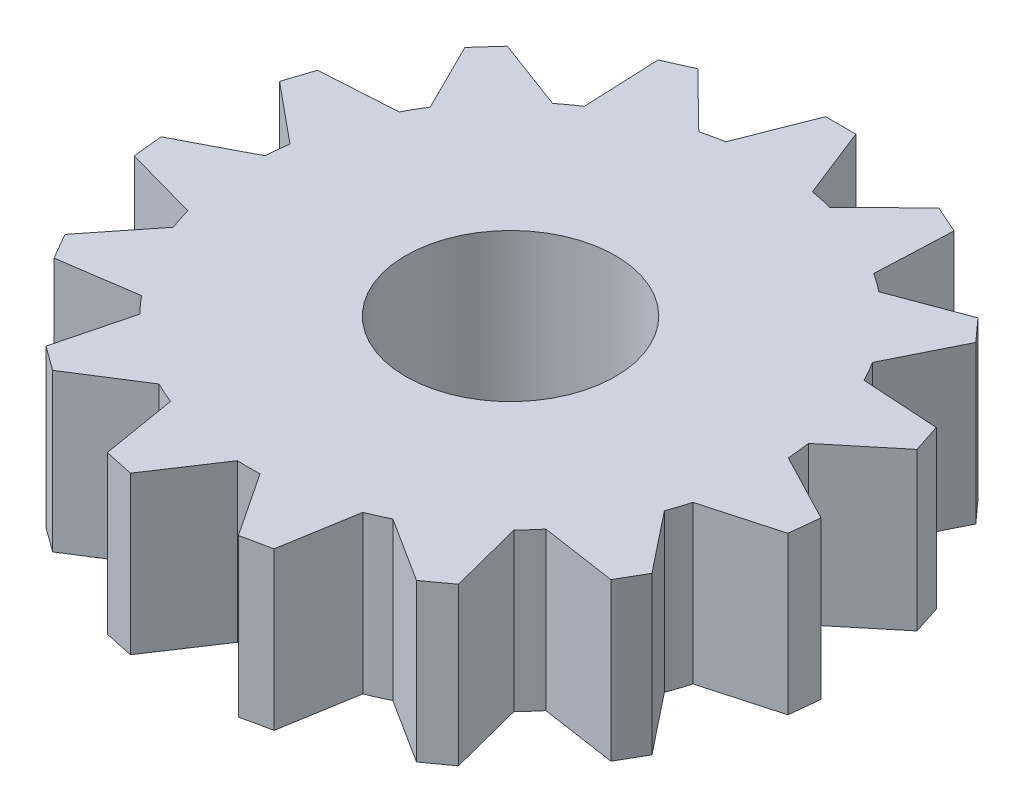
from build123d import *

# Parameters (mm, degrees)
SKETCH1_R           = 1
BOSS_EXTRUDE1_DEPTH = 1.5


with BuildPart() as part:
    # Sketch1 → Boss-Extrude1 (new body)
    with BuildSketch(Plane(origin=(0, 0, 0), x_dir=(1, 0, 0), z_dir=(0, 1, 0))):
        with BuildLine():
            Line((-0.4136064, 2.465548569), (-0.143377771, 3.149767964))
            Line((-0.143377771, 3.149767964), (0.143377771, 3.149767964))
            Line((0.143377771, 3.149767964), (0.4136064, 2.465548569))
            ThreePointArc((0.4136064, 2.465548569), (0.519779227, 2.445369002), (0.6249807, 2.420619575))
            Line((0.6249807, 2.420619575), (1.150143936, 2.935773209))
            Line((1.150143936, 2.935773209), (1.41210816, 2.819139222))
            Line((1.41210816, 2.819139222), (1.380677197, 2.084161817))
            ThreePointArc((1.380677197, 2.084161817), (1.469463131, 2.022542486), (1.55550296, 1.957143465))
            Line((1.55550296, 1.957143465), (2.244795308, 2.214156596))
            Line((2.244795308, 2.214156596), (2.436672219, 2.001055698))
            Line((2.436672219, 2.001055698), (2.109016362, 1.342404553))
            ThreePointArc((2.109016362, 1.342404553), (2.165063509, 1.25), (2.217064626, 1.15525947))
            Line((2.217064626, 1.15525947), (2.951301179, 1.109692193))
            Line((2.951301179, 1.109692193), (3.039913515, 0.836971465))
            Line((3.039913515, 0.836971465), (2.472687439, 0.368533346))
            ThreePointArc((2.472687439, 0.368533346), (2.486304738, 0.261321158), (2.495275677, 0.153620618))
            Line((2.495275677, 0.153620618), (3.147500263, -0.186648072))
            Line((3.147500263, -0.186648072), (3.117526147, -0.471832738))
            Line((3.117526147, -0.471832738), (2.408808394, -0.669060624))
            ThreePointArc((2.408808394, -0.669060624), (2.377641291, -0.772542486), (2.342030895, -0.874580635))
            Line((2.342030895, -0.874580635), (2.799467958, -1.450715189))
            Line((2.799467958, -1.450715189), (2.656090187, -1.699052774))
            Line((2.656090187, -1.699052774), (1.928424495, -1.590967934))
            ThreePointArc((1.928424495, -1.590967934), (1.857862064, -1.672826516), (1.783827694, -1.75155895))
            Line((1.783827694, -1.75155895), (1.967382211, -2.463940471))
            Line((1.967382211, -2.463940471), (1.735392103, -2.63249115))
            Line((1.735392103, -2.63249115), (1.114598481, -2.237782435))
            ThreePointArc((1.114598481, -2.237782435), (1.016841608, -2.283863644), (0.91718448, -2.325676811))
            Line((0.91718448, -2.325676811), (0.795118206, -3.051128062))
            Line((0.795118206, -3.051128062), (0.51462896, -3.110747891))
            Line((0.51462896, -3.110747891), (0.108048264, -2.497664023))
            ThreePointArc((0.108048264, -2.497664023), (0, -2.5), (-0.108048264, -2.497664023))
            Line((-0.108048264, -2.497664023), (-0.51462896, -3.110747891))
            Line((-0.51462896, -3.110747891), (-0.795118206, -3.051128062))
            Line((-0.795118206, -3.051128062), (-0.91718448, -2.325676811))
            ThreePointArc((-0.91718448, -2.325676811), (-1.016841608, -2.283863644), (-1.114598481, -2.237782435))
            Line((-1.114598481, -2.237782435), (-1.735392103, -2.63249115))
            Line((-1.735392103, -2.63249115), (-1.967382211, -2.463940471))
            Line((-1.967382211, -2.463940471), (-1.783827694, -1.75155895))
            ThreePointArc((-1.783827694, -1.75155895), (-1.857862064, -1.672826516), (-1.928424495, -1.590967934))
            Line((-1.928424495, -1.590967934), (-2.656090187, -1.699052774))
            Line((-2.656090187, -1.699052774), (-2.799467958, -1.450715189))
            Line((-2.799467958, -1.450715189), (-2.342030895, -0.874580635))
            ThreePointArc((-2.342030895, -0.874580635), (-2.377641291, -0.772542486), (-2.408808394, -0.669060624))
            Line((-2.408808394, -0.669060624), (-3.117526147, -0.471832738))
            Line((-3.117526147, -0.471832738), (-3.147500263, -0.186648072))
            Line((-3.147500263, -0.186648072), (-2.495275677, 0.153620618))
            ThreePointArc((-2.495275677, 0.153620618), (-2.486304738, 0.261321158), (-2.472687439, 0.368533346))
            Line((-2.472687439, 0.368533346), (-3.039913515, 0.836971465))
            Line((-3.039913515, 0.836971465), (-2.951301179, 1.109692193))
            Line((-2.951301179, 1.109692193), (-2.217064626, 1.15525947))
            ThreePointArc((-2.217064626, 1.15525947), (-2.165063509, 1.25), (-2.109016362, 1.342404553))
            Line((-2.109016362, 1.342404553), (-2.436672219, 2.001055698))
            Line((-2.436672219, 2.001055698), (-2.244795308, 2.214156596))
            Line((-2.244795308, 2.214156596), (-1.55550296, 1.957143465))
            ThreePointArc((-1.55550296, 1.957143465), (-1.469463131, 2.022542486), (-1.380677197, 2.084161817))
            Line((-1.380677197, 2.084161817), (-1.41210816, 2.819139222))
            Line((-1.41210816, 2.819139222), (-1.150143936, 2.935773209))
            Line((-1.150143936, 2.935773209), (-0.6249807, 2.420619575))
            ThreePointArc((-0.6249807, 2.420619575), (-0.519779227, 2.445369002), (-0.4136064, 2.465548569))
        make_face()
        with Locations(Location((0, 0, 0), (0, 0, 270))):
            Circle(SKETCH1_R, mode=Mode.SUBTRACT)
    extrude(amount=BOSS_EXTRUDE1_DEPTH)


solid = part.part
